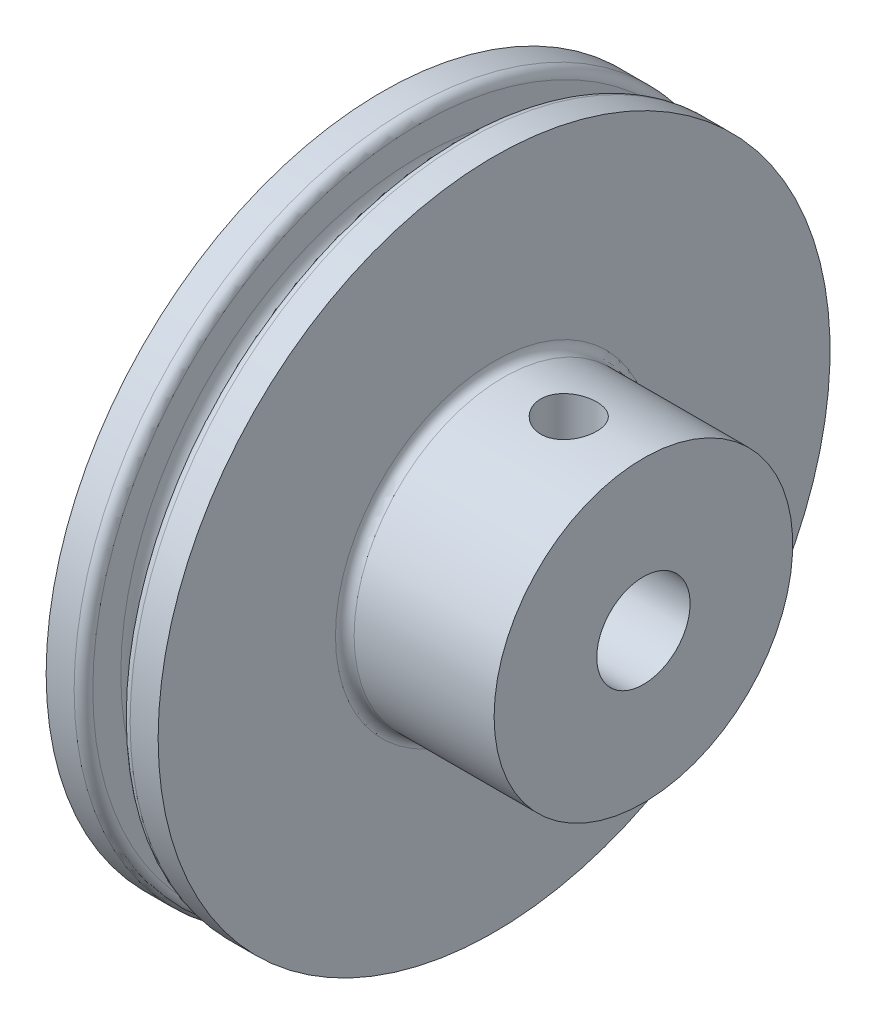
from build123d import *

# Parameters (mm, degrees)
CUT_EXTRUDE3_DEPTH      = 2
CUT_EXTRUDE3_DEPTH_BACK = 8
SKETCH7_R               = 1.5


with BuildPart() as part:
    # Sketch1 → Revolve1 (revolve)
    with BuildSketch(Plane.XY, mode=Mode.PRIVATE) as revolve1_sk:
        with BuildLine():
            Line((-11.54268079, 10.022902393), (-10.04268079, 10.022902393))
            ThreePointArc((-10.04268079, 10.022902393), (-9.689127399, 9.876455783), (-9.54268079, 9.522902393))
            Line((-9.54268079, 9.522902393), (-9.54268079, 8.022902453))
            ThreePointArc((-9.54268079, 8.022902453), (-8.54268079, 7.022902453), (-7.54268079, 8.022902453))
            Line((-7.54268079, 8.022902453), (-7.54268079, 9.522902393))
            ThreePointArc((-7.54268079, 9.522902393), (-7.396234181, 9.876455783), (-7.04268079, 10.022902393))
            Line((-7.04268079, 10.022902393), (-5.54268079, 10.022902393))
            Line((-5.54268079, 10.022902393), (-5.54268079, 0.522902393))
            ThreePointArc((-5.54268079, 0.522902393), (-5.396234181, 0.169349002), (-5.04268079, 0.022902393))
            Line((-5.04268079, 0.022902393), (2.45731921, 0.022902393))
            Line((2.45731921, 0.022902393), (2.45731921, -5.477097607))
            Line((2.45731921, -5.477097607), (-11.54268079, -5.477097607))
            Line((-11.54268079, -5.477097607), (-11.54268079, 10.022902393))
        make_face()
    revolve(revolve1_sk.sketch.rotate(Axis((-11.54268079, -7.977097607, 0), (1, 0, 0)), 90), axis=Axis((-11.54268079, -7.977097607, 0), (1, 0, 0)))

    # Sketch7 → Cut-Extrude3 (cut, two sides: drawn at the far end of the back side and taken through both)
    with BuildSketch(Plane(origin=(0, 0, 0), x_dir=(1, 0, 0), z_dir=(0, 1, 0)).offset(-CUT_EXTRUDE3_DEPTH_BACK)):
        with Locations(Location((-1.54268079, 0, 0), (0, 0, 90))):
            Circle(SKETCH7_R)
    extrude(amount=CUT_EXTRUDE3_DEPTH + CUT_EXTRUDE3_DEPTH_BACK, mode=Mode.SUBTRACT)


solid = part.part
